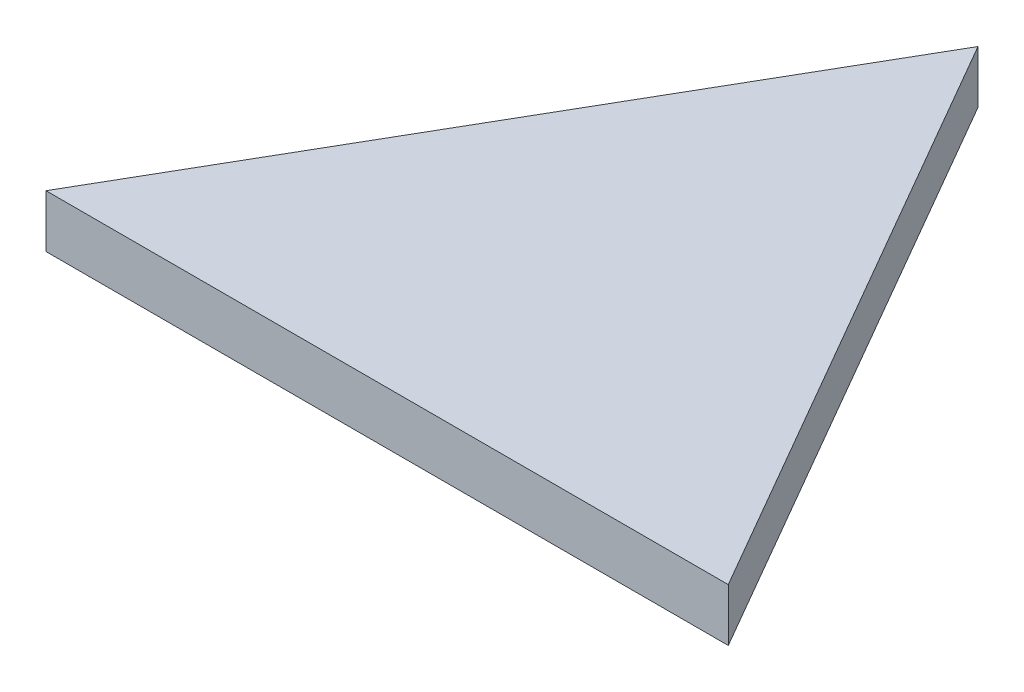
from build123d import *

# Parameters (mm, degrees)
BOSS_EXTRUDE1_DEPTH = 17
SKETCH3_R           = 2
CUT_EXTRUDE2_DEPTH  = 14


with BuildPart() as part:
    # Sketch2 → Boss-Extrude1 (new body)
    with BuildSketch(Plane(origin=(0, 0, 0), x_dir=(1, 0, 0), z_dir=(0, 1, 0))):
        Polygon((-41.583286951, 150.67482391), (-151.583286951, -39.850764923), (68.416713049, -39.850764923), align=None)
    extrude(amount=BOSS_EXTRUDE1_DEPTH)

    # Sketch3 → Cut-Extrude2 (cut)
    with BuildSketch(Plane.XZ):
        with Locations(Location((-145.521109124, 36.350764923, 0), (0, 0, 270))):
            Circle(SKETCH3_R)
        with Locations(Location((62.354535223, 36.350764923, 0), (0, 0, 270))):
            Circle(SKETCH3_R)
        with Locations(Location((-41.583286951, -143.67482391, 0), (0, 0, 270))):
            Circle(SKETCH3_R)
    extrude(amount=-CUT_EXTRUDE2_DEPTH, mode=Mode.SUBTRACT)


solid = part.part
